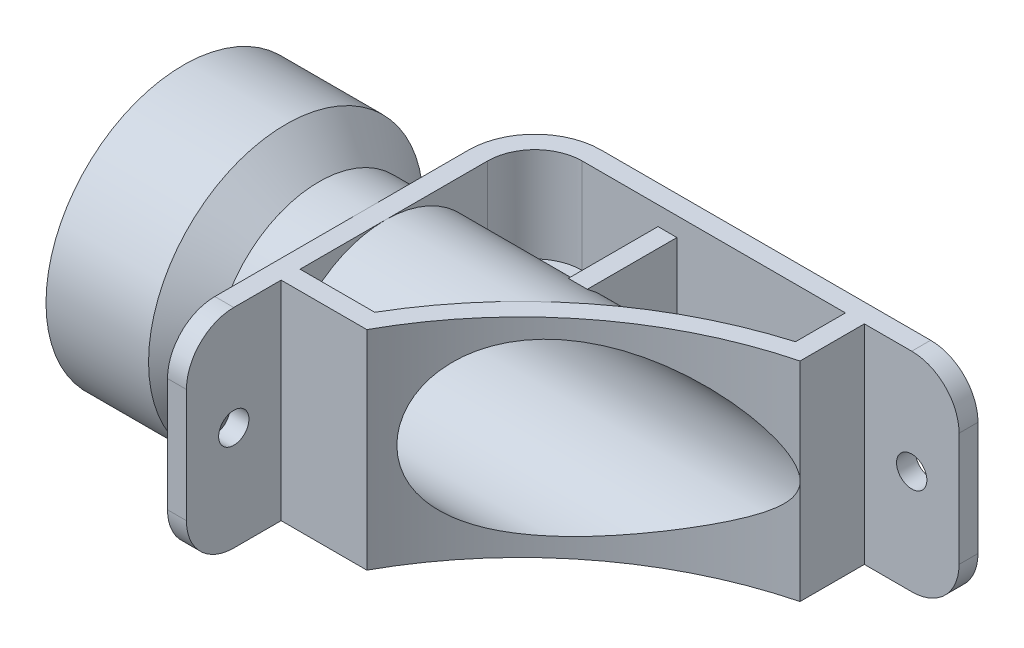
from build123d import *
from build123d.topology import SkipClean

# Parameters (mm, degrees)
EXTRUDE_1_DEPTH                 = 11
EXTRUDE_1_DEPTH_BACK            = 11
EXTRUDE_6_REACH                 = 52.677
EXTRUDE_6_END_RADIUS            = 43
SKETCH_4_R                      = 11
EXTRUDE_6_DIRECTION_2_DEPTH     = 7
RIB_11_REACH                    = 52.677
SKETCH_7_WALL_W                 = 108.144859428
SKETCH_7_WALL_H                 = 2
RIB_12_REACH                    = 52.677
SKETCH_7_2_WALL_W               = 108.144859428
SKETCH_7_2_WALL_H               = 2
RIB_14_REACH                    = 40.859
SKETCH_8_WALL_W                 = 89.184699428
SKETCH_8_WALL_H                 = 2
CUT_EXTRUDE_1_REACH             = 52.677
CUT_EXTRUDE_1_END_RADIUS        = 41
SKETCH_9_R                      = 9
CUT_EXTRUDE_1_DIRECTION_2_DEPTH = 7
CUT_EXTRUDE_2_REACH             = 52.677
SKETCH_10_R                     = 1.6
CUT_EXTRUDE_3_REACH             = 60.998
SKETCH_11_R                     = 1.6
FILLET_1_R                      = 5


with BuildPart() as part:
    # 草图2 → 凸台-拉伸1 (new, two sides: drawn at the far end of the back side and taken through both)
    with BuildSketch(Plane(origin=(0, 0, 0), x_dir=(1, 0, 0), z_dir=(0, 1, 0)).offset(-EXTRUDE_1_DEPTH_BACK)):
        with BuildLine():
            Line((-2, 10.791694934), (-2, -21))
            Line((-2, -21), (0, -21))
            Line((0, -21), (0, -11))
            Line((0, -11), (9.04749367, -11))
            ThreePointArc((9.04749367, -11), (19.845447894, 1.668361044), (34.789686155, 9))
            Line((34.789686155, 9), (34.789686155, 15.791694934))
            Line((34.789686155, 15.791694934), (44.789686155, 15.791694934))
            Line((44.789686155, 15.791694934), (44.789686155, 17.791694934))
            Line((44.789686155, 17.791694934), (5, 17.791694934))
            ThreePointArc((5, 17.791694934), (0.050252532, 15.741442403), (-2, 10.791694934))
        make_face()
        with BuildLine():
            Line((0, 10.791694934), (0, -9))
            Line((0, -9), (7.881951948, -9))
            ThreePointArc((7.881951948, -9), (18.474626995, 3.135521358), (32.789686155, 10.521638371))
            Line((32.789686155, 10.521638371), (32.789686155, 15.791694934))
            Line((32.789686155, 15.791694934), (5, 15.791694934))
            ThreePointArc((5, 15.791694934), (1.464466094, 14.32722884), (0, 10.791694934))
        make_face(mode=Mode.SUBTRACT)
    extrude(amount=EXTRUDE_1_DEPTH + EXTRUDE_1_DEPTH_BACK)

    # 凸台-拉伸6: up to this cylinder (the profile starts outside it)
    extrude_6_end = Plane(origin=(45, 0, 30.708305066), z_dir=(0, 1, 0)) * Cylinder(EXTRUDE_6_END_RADIUS, 192.354, mode=Mode.PRIVATE)
    # 草图4 → 凸台-拉伸6 (add, up to the surface)
    with BuildSketch(Plane(origin=(0, 0, 0), x_dir=(0, 0, -1), z_dir=(1, 0, 0)), mode=Mode.PRIVATE) as extrude_6_sk1:
        Circle(SKETCH_4_R)
    extrude_6_tool1 = extrude(extrude_6_sk1.sketch, amount=EXTRUDE_6_REACH, mode=Mode.PRIVATE) - extrude_6_end
    add(extrude_6_tool1.solids().sort_by_distance((0, 0, 0))[0])

    # 草图4 → 凸台-拉伸6 direction 2 (add)
    with BuildSketch(Plane(origin=(0, 0, 0), x_dir=(0, 0, -1), z_dir=(1, 0, 0))):
        Circle(SKETCH_4_R)
    extrude(amount=-EXTRUDE_6_DIRECTION_2_DEPTH)

    # 草图7 wall → 筋11 (add, up to next)
    with BuildSketch(Plane(origin=(18.894843077, 0, -13.395847467), x_dir=(0, 0, 1), z_dir=(1, 0, 0)), mode=Mode.PRIVATE) as rib_11_sk1:
        Rectangle(SKETCH_7_WALL_W, SKETCH_7_WALL_H)
    rib_11_tool1 = extrude(rib_11_sk1.sketch, amount=-RIB_11_REACH, mode=Mode.PRIVATE) - part.part
    add(rib_11_tool1.solids().sort_by_distance((18.894843077, 0, -13.395847467))[0])

    # 草图7<2> wall → 筋12 (add, up to next)
    with BuildSketch(Plane(origin=(18.894843077, 0, -13.395847467), x_dir=(0, 0, 1), z_dir=(1, 0, 0)), mode=Mode.PRIVATE) as rib_12_sk1:
        Rectangle(SKETCH_7_2_WALL_W, SKETCH_7_2_WALL_H)
    rib_12_tool1 = extrude(rib_12_sk1.sketch, amount=RIB_12_REACH, mode=Mode.PRIVATE) - part.part
    add(rib_12_tool1.solids().sort_by_distance((18.894843077, 0, -13.395847467))[0])

    # 草图8 wall → 筋14 (add, up to next)
    with BuildSketch(Plane(origin=(14, 9, -11.058125127), x_dir=(0, 0, 1), z_dir=(0, -1, 0)), mode=Mode.PRIVATE) as rib_14_sk1:
        Rectangle(SKETCH_8_WALL_W, SKETCH_8_WALL_H)
    rib_14_tool1 = extrude(rib_14_sk1.sketch, amount=RIB_14_REACH, mode=Mode.PRIVATE) - part.part
    rib_14 = rib_14_tool1.solids().sort_by_distance((14, 9, -11.058125127))[0]
    add(rib_14)

    # 镜向1: 筋14 across plane
    add(rib_14.mirror(Plane.ZX))

    # 切除-拉伸1: up to this cylinder (the profile starts outside it)
    cut_extrude_1_end = Plane(origin=(45, 0, 30.708305066), z_dir=(0, 1, 0)) * Cylinder(CUT_EXTRUDE_1_END_RADIUS, 188.354, mode=Mode.PRIVATE)
    # 草图9 → 切除-拉伸1 (cut, up to the surface)
    with BuildSketch(Plane(origin=(0, 0, 0), x_dir=(0, 0, -1), z_dir=(1, 0, 0)), mode=Mode.PRIVATE) as cut_extrude_1_sk1:
        Circle(SKETCH_9_R)
    cut_extrude_1_tool1 = extrude(cut_extrude_1_sk1.sketch, amount=CUT_EXTRUDE_1_REACH, mode=Mode.PRIVATE) - cut_extrude_1_end
    add(cut_extrude_1_tool1.solids().sort_by_distance((0, 0, 0))[0], mode=Mode.SUBTRACT)

    # 草图9 → 切除-拉伸1 direction 2 (cut)
    with BuildSketch(Plane(origin=(0, 0, 0), x_dir=(0, 0, -1), z_dir=(1, 0, 0))):
        Circle(SKETCH_9_R)
    extrude(amount=-CUT_EXTRUDE_1_DIRECTION_2_DEPTH, mode=Mode.SUBTRACT)

    # 草图10 → 切除-拉伸2 (cut, up to next)
    with BuildSketch(Plane(origin=(0, 0, 0), x_dir=(0, 0, -1), z_dir=(1, 0, 0)), mode=Mode.PRIVATE) as cut_extrude_2_sk1:
        with Locations((-16, 0)):
            Circle(SKETCH_10_R)
    cut_extrude_2_tool1 = extrude(cut_extrude_2_sk1.sketch, amount=-CUT_EXTRUDE_2_REACH, mode=Mode.PRIVATE) & part.part
    add(cut_extrude_2_tool1.solids().sort_by_distance((0, 0, 16))[0], mode=Mode.SUBTRACT)

    # 草图11 → 切除-拉伸3 (cut, up to next)
    with BuildSketch(Plane.XY.offset(-15.791694934), mode=Mode.PRIVATE) as cut_extrude_3_sk1:
        with Locations((39.789686155, 0)):
            Circle(SKETCH_11_R)
    cut_extrude_3_tool1 = extrude(cut_extrude_3_sk1.sketch, amount=-CUT_EXTRUDE_3_REACH, mode=Mode.PRIVATE) & part.part
    add(cut_extrude_3_tool1.solids().sort_by_distance((39.789686, 0, -15.791695))[0], mode=Mode.SUBTRACT)

    # 圆角1
    fillet_1_edges = [part.edges().sort_by_distance(p)[0] for p in [
        (44.789686155, -11, -16.791694934),
        (-1, -11, 21),
        (-1, 11, 21),
        (44.789686155, 11, -16.791694934),
    ]]
    fillet(fillet_1_edges, radius=FILLET_1_R)

    # 草图14 → 旋转1 (revolve)
    with SkipClean():  # the faces are left unmerged after this step: merging them gives an invalid solid
        with BuildSketch(Plane.XY, mode=Mode.PRIVATE) as revolve_1_sk:
            Polygon((-10.5, 14.5), (-21.328427125, 14.5), (-21.328427125, 12.5), (-11.328427125, 12.5), (-7.828427125, 9), (-7, 9), (-7, 11), align=None)
        revolve(revolve_1_sk.sketch.rotate(Axis((-18.782404652, 0, 0), (1, 0, 0)), 90), axis=Axis((-18.782404652, 0, 0), (1, 0, 0)))


solid = part.part
